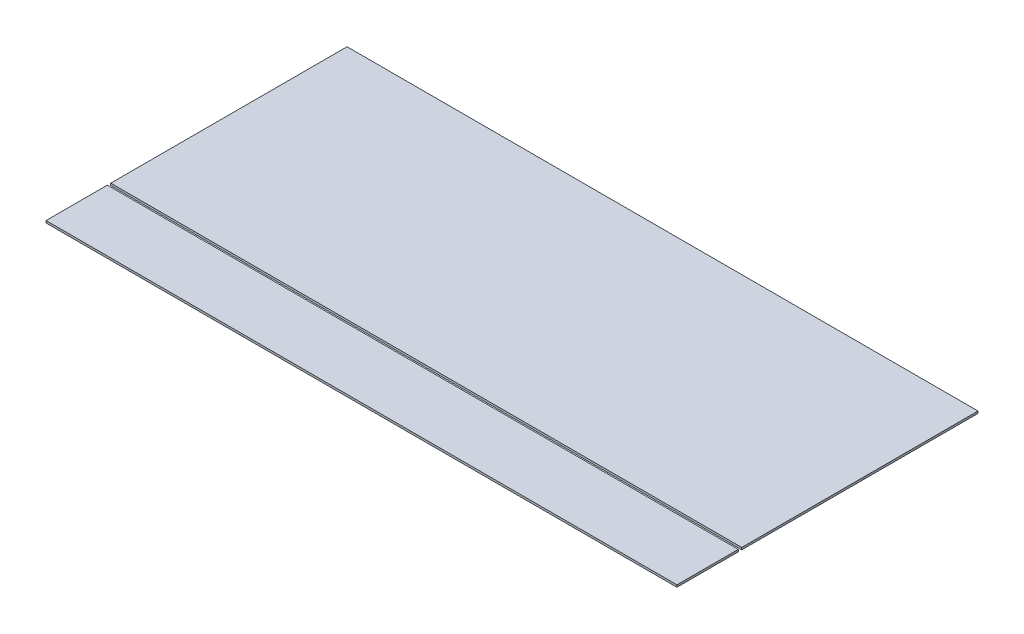
from build123d import *

# Parameters (mm, degrees)
BOSS_EXTRUDE1_DEPTH             = 2.5
BOSS_EXTRUDE1_DEPTH_BACK        = 2.5
SKETCH1_W                       = 1473.2
SKETCH1_H                       = 544.2
BOSS_EXTRUDE1_2_DEPTH           = 2.5
BOSS_EXTRUDE1_2_DEPTH_BACK      = 2.5
SKETCH1_H_2                     = 132.4
BOSS_EXTRUDE2_REACH             = 816.8
SKETCH2_W                       = 1485.2
SKETCH2_H                       = 556.2
SKETCH2_W_2                     = 1473.2
SKETCH2_H_2                     = 544.2
SKETCH2_H_3                     = 144.4
SKETCH2_H_4                     = 132.4
BOSS_EXTRUDE2_DIRECTION_2_REACH = 816.8


with BuildPart() as part:
    # Sketch1 → Boss-Extrude1 (new, two sides: drawn at the far end of the back side and taken through both)
    with BuildSketch(Plane(origin=(0, 0, 0), x_dir=(1, 0, 0), z_dir=(0, 1, 0)).offset(-BOSS_EXTRUDE1_DEPTH_BACK)):
        with Locations((0, 76.2)):
            Rectangle(SKETCH1_W, SKETCH1_H)
    extrude(amount=BOSS_EXTRUDE1_DEPTH + BOSS_EXTRUDE1_DEPTH_BACK)

    # Boss-Extrude2: up to this face of the body (flat: up to its plane)
    boss_extrude2_end = Plane(part.part.faces().sort_by_distance((0, 2.5, -76.2))[0])
    # Sketch2 → Boss-Extrude2 (add, up to the picked face)
    with BuildSketch(Plane(origin=(0, 0, 0), x_dir=(1, 0, 0), z_dir=(0, 1, 0)), mode=Mode.PRIVATE) as boss_extrude2_sk1:
        with Locations((0, 76.2)):
            Rectangle(SKETCH2_W, SKETCH2_H)
        with Locations((0, 76.2)):
            Rectangle(SKETCH2_W_2, SKETCH2_H_2, mode=Mode.SUBTRACT)
    boss_extrude2_tool1 = split(extrude(boss_extrude2_sk1.sketch, amount=BOSS_EXTRUDE2_REACH, mode=Mode.PRIVATE), bisect_by=boss_extrude2_end, keep=Keep.BOTH, mode=Mode.PRIVATE)
    # Sketch2 → Boss-Extrude2 (add, up to the picked face)
    with BuildSketch(Plane(origin=(0, 0, 0), x_dir=(1, 0, 0), z_dir=(0, 1, 0)), mode=Mode.PRIVATE) as boss_extrude2_sk2:
        with Locations((0, -282.1)):
            Rectangle(SKETCH2_W, SKETCH2_H_3)
        with Locations((0, -282.1)):
            Rectangle(SKETCH2_W_2, SKETCH2_H_4, mode=Mode.SUBTRACT)
    boss_extrude2_tool2 = split(extrude(boss_extrude2_sk2.sketch, amount=BOSS_EXTRUDE2_REACH, mode=Mode.PRIVATE), bisect_by=boss_extrude2_end, keep=Keep.BOTH, mode=Mode.PRIVATE)


with BuildPart() as body_2:
    # Sketch1 → Boss-Extrude1 2 (new, two sides: drawn at the far end of the back side and taken through both)
    with BuildSketch(Plane(origin=(0, 0, 0), x_dir=(1, 0, 0), z_dir=(0, 1, 0)).offset(-BOSS_EXTRUDE1_2_DEPTH_BACK)):
        with Locations((0, -282.1)):
            Rectangle(SKETCH1_W, SKETCH1_H_2)
    extrude(amount=BOSS_EXTRUDE1_2_DEPTH + BOSS_EXTRUDE1_2_DEPTH_BACK)


with BuildPart() as part_1:
    add(part.part)

    add(body_2.part)  # Boss-Extrude2 merges body 2
    add(boss_extrude2_tool1.solids().sort_by(Axis((0, 0, -352.714069), (0, 1, 0)))[0])
    add(boss_extrude2_tool2.solids().sort_by(Axis((0, 0, 352.807797), (0, 1, 0)))[0])

    # Boss-Extrude2 direction 2: up to this face of the body (flat: up to its plane)
    boss_extrude2_direction_2_end = Plane(part_1.part.faces().sort_by_distance((0, -2.5, -76.2))[0])
    # Sketch2 → Boss-Extrude2 direction 2 (add, up to the picked face)
    with BuildSketch(Plane(origin=(0, 0, 0), x_dir=(1, 0, 0), z_dir=(0, 1, 0)), mode=Mode.PRIVATE) as boss_extrude2_direction_2_sk1:
        with Locations((0, 76.2)):
            Rectangle(SKETCH2_W, SKETCH2_H)
        with Locations((0, 76.2)):
            Rectangle(SKETCH2_W_2, SKETCH2_H_2, mode=Mode.SUBTRACT)
    boss_extrude2_direction_2_tool1 = split(extrude(boss_extrude2_direction_2_sk1.sketch, amount=-BOSS_EXTRUDE2_DIRECTION_2_REACH, mode=Mode.PRIVATE), bisect_by=boss_extrude2_direction_2_end, keep=Keep.BOTH, mode=Mode.PRIVATE)
    # Sketch2 → Boss-Extrude2 direction 2 (add, up to the picked face)
    with BuildSketch(Plane(origin=(0, 0, 0), x_dir=(1, 0, 0), z_dir=(0, 1, 0)), mode=Mode.PRIVATE) as boss_extrude2_direction_2_sk2:
        with Locations((0, -282.1)):
            Rectangle(SKETCH2_W, SKETCH2_H_3)
        with Locations((0, -282.1)):
            Rectangle(SKETCH2_W_2, SKETCH2_H_4, mode=Mode.SUBTRACT)
    boss_extrude2_direction_2_tool2 = split(extrude(boss_extrude2_direction_2_sk2.sketch, amount=-BOSS_EXTRUDE2_DIRECTION_2_REACH, mode=Mode.PRIVATE), bisect_by=boss_extrude2_direction_2_end, keep=Keep.BOTH, mode=Mode.PRIVATE)
    add(boss_extrude2_direction_2_tool1.solids().sort_by(Axis((0, 0, -352.714069), (0, -1, 0)))[0])
    add(boss_extrude2_direction_2_tool2.solids().sort_by(Axis((0, 0, 352.807797), (0, -1, 0)))[0])


solid = part_1.part
